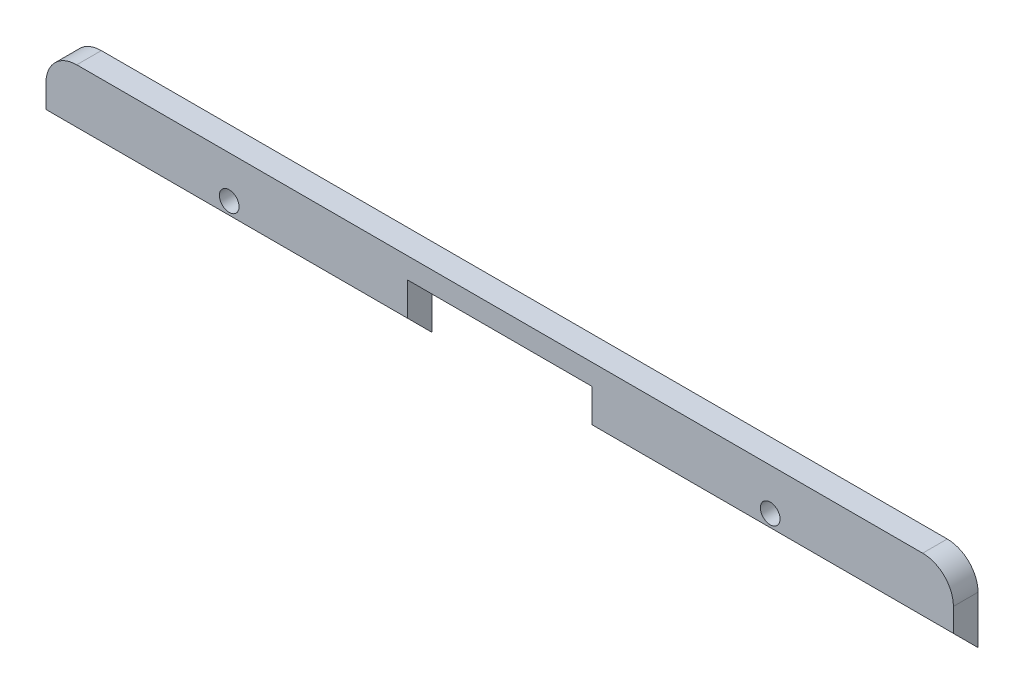
from build123d import *

# Parameters (mm, degrees)
BOSS_EXTRUDE1_DEPTH   = 36.9
M2X0_4_TAPPED_HOLE1_D = 1.6
SKETCH4_W             = 15
SKETCH4_H             = 4.7
CUT_EXTRUDE4_DEPTH    = 38.092452062
FILLET3_R             = 2.5


with BuildPart() as part:
    # Sketch1 → Boss-Extrude1 (new, symmetric)
    with BuildSketch(Plane(origin=(0, 0, 0), x_dir=(0, 0, -1), z_dir=(1, 0, 0))):
        Polygon((0, -3.2), (-2, -1.2), (-2, 3.2), (0, 3.2), align=None)
    extrude(amount=BOSS_EXTRUDE1_DEPTH, both=True)

    # M2x0.4 Tapped Hole1 (through all)
    with Locations(Plane.XY.offset(2)):
        with Locations((22, -0.2), (0, -0.2), (-22, -0.2)):
            Hole(M2X0_4_TAPPED_HOLE1_D / 2)

    # Sketch4 → Cut-Extrude4 (cut, through all)
    with BuildSketch(Plane.XY):
        with Locations((0, -0.85)):
            Rectangle(SKETCH4_W, SKETCH4_H)
    extrude(amount=CUT_EXTRUDE4_DEPTH, mode=Mode.SUBTRACT)

    # Fillet3
    fillet3_edges = [part.edges().sort_by_distance(p)[0] for p in [
        (-36.9, 3.2, 1),
        (36.9, 3.2, 1),
    ]]
    fillet(fillet3_edges, radius=FILLET3_R)


solid = part.part
